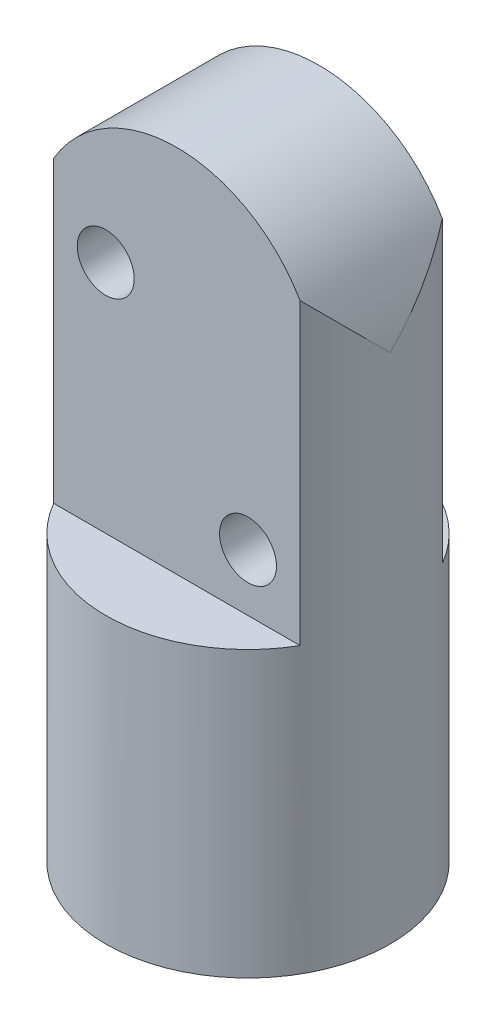
from build123d import *

# Parameters (mm, degrees)
SKETCH_1_R          = 25
SKETCH_1_R_2        = 10
EXTRUDE_1_DEPTH     = 50
EXTRUDE_2_DEPTH     = 12.5
CUT_EXTRUDE_1_DEPTH = 74.993242935
SKETCH_5_R          = 5
CUT_EXTRUDE_2_DEPTH = 124.51619327


with BuildPart() as part:
    # 草图1 → 凸台-拉伸1 (new body)
    with BuildSketch(Plane(origin=(0, 0, 0), x_dir=(1, 0, 0), z_dir=(0, 1, 0))):
        with Locations(Location((0, 0, 0), (0, 0, 270))):
            Circle(SKETCH_1_R)
        with Locations(Location((0, 0, 0), (0, 0, 270))):
            Circle(SKETCH_1_R_2, mode=Mode.SUBTRACT)
    extrude(amount=EXTRUDE_1_DEPTH)

    # 草图2 → 凸台-拉伸2 (add, symmetric)
    with BuildSketch(Plane.XY):
        with BuildLine():
            Line((-25, 50), (25, 50))
            Line((25, 50), (25, 90))
            ThreePointArc((25, 90), (0, 115), (-25, 90))
            Line((-25, 90), (-25, 50))
        make_face()
    extrude(amount=EXTRUDE_2_DEPTH, both=True)

    # 草图4 → 切除-拉伸1 (cut, through all)
    with BuildSketch(Plane.XZ.offset(-50)):
        with BuildLine():
            Line((21.650635095, -12.5), (25, -12.5))
            Line((25, -12.5), (25, 0))
            ThreePointArc((25, 0), (24.148145657, -6.470476128), (21.650635095, -12.5))
        make_face()
        with BuildLine():
            ThreePointArc((21.650635095, 12.5), (24.148145657, 6.470476128), (25, 0))
            Line((25, 0), (25, 12.5))
            Line((25, 12.5), (21.650635095, 12.5))
        make_face()
        with BuildLine():
            Line((-25, 0), (-25, -12.5))
            Line((-25, -12.5), (-21.650635095, -12.5))
            ThreePointArc((-21.650635095, -12.5), (-24.148145657, -6.470476128), (-25, 0))
        make_face()
        with BuildLine():
            Line((-25, 12.5), (-25, 0))
            ThreePointArc((-25, 0), (-24.148145657, 6.470476128), (-21.650635095, 12.5))
            Line((-21.650635095, 12.5), (-25, 12.5))
        make_face()
    extrude(amount=-CUT_EXTRUDE_1_DEPTH, mode=Mode.SUBTRACT)

    # 草图5 → 切除-拉伸2 (cut, through all)
    with BuildSketch(Plane.XY.offset(12.5)):
        with Locations((-12.5, 91.224989992)):
            Circle(SKETCH_5_R)
        with Locations((12.5, 60)):
            Circle(SKETCH_5_R)
    extrude(amount=-CUT_EXTRUDE_2_DEPTH, mode=Mode.SUBTRACT)


solid = part.part
